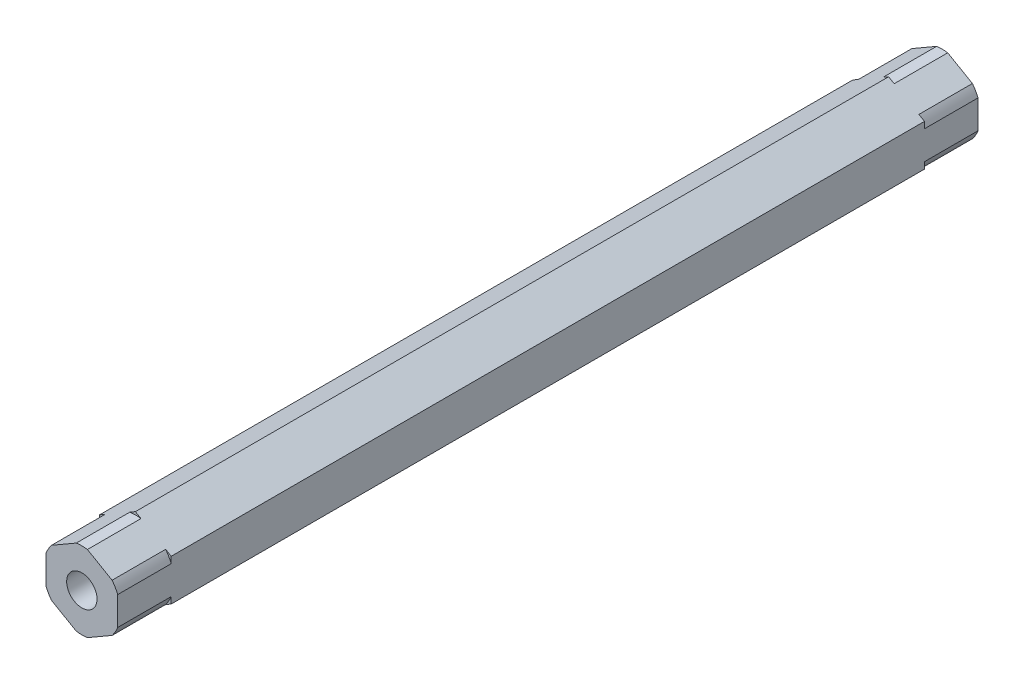
from build123d import *

# Parameters (mm, degrees)
BOSS_EXTRUDE1_DEPTH = 57.15
SKETCH2_R           = 2.0193
CUT_EXTRUDE1_DEPTH  = 19.05
SKETCH4_R           = 7.057360916
SKETCH4_R_2         = 5.125
CUT_EXTRUDE2_DEPTH  = 7.112


with BuildPart() as part:
    # Sketch1 → Boss-Extrude1 (new, symmetric)
    with BuildSketch(Plane.XY):
        Polygon((4.7625, 2.749630657), (0, 5.499261314), (-4.7625, 2.749630657), (-4.7625, -2.749630657), (0, -5.499261314), (4.7625, -2.749630657), align=None)
    extrude(amount=BOSS_EXTRUDE1_DEPTH, both=True)

    # Sketch2 → Cut-Extrude1 (cut)
    with BuildSketch(Plane(origin=(0, 0, -57.15), x_dir=(-1, 0, 0), z_dir=(0, 0, -1))):
        Circle(SKETCH2_R)
    cut_extrude1 = extrude(amount=-CUT_EXTRUDE1_DEPTH, mode=Mode.SUBTRACT)

    # Mirror1: Cut-Extrude1 across plane
    add(cut_extrude1.mirror(Plane.XY), mode=Mode.SUBTRACT)

    # Sketch4 → Cut-Extrude2 (cut)
    with BuildSketch(Plane.XY.offset(57.15)):
        Circle(SKETCH4_R)
        Circle(SKETCH4_R_2, mode=Mode.SUBTRACT)
    cut_extrude2 = extrude(amount=-CUT_EXTRUDE2_DEPTH, mode=Mode.SUBTRACT)

    # Mirror2: Cut-Extrude2 across plane
    add(cut_extrude2.mirror(Plane.XY), mode=Mode.SUBTRACT)


solid = part.part
